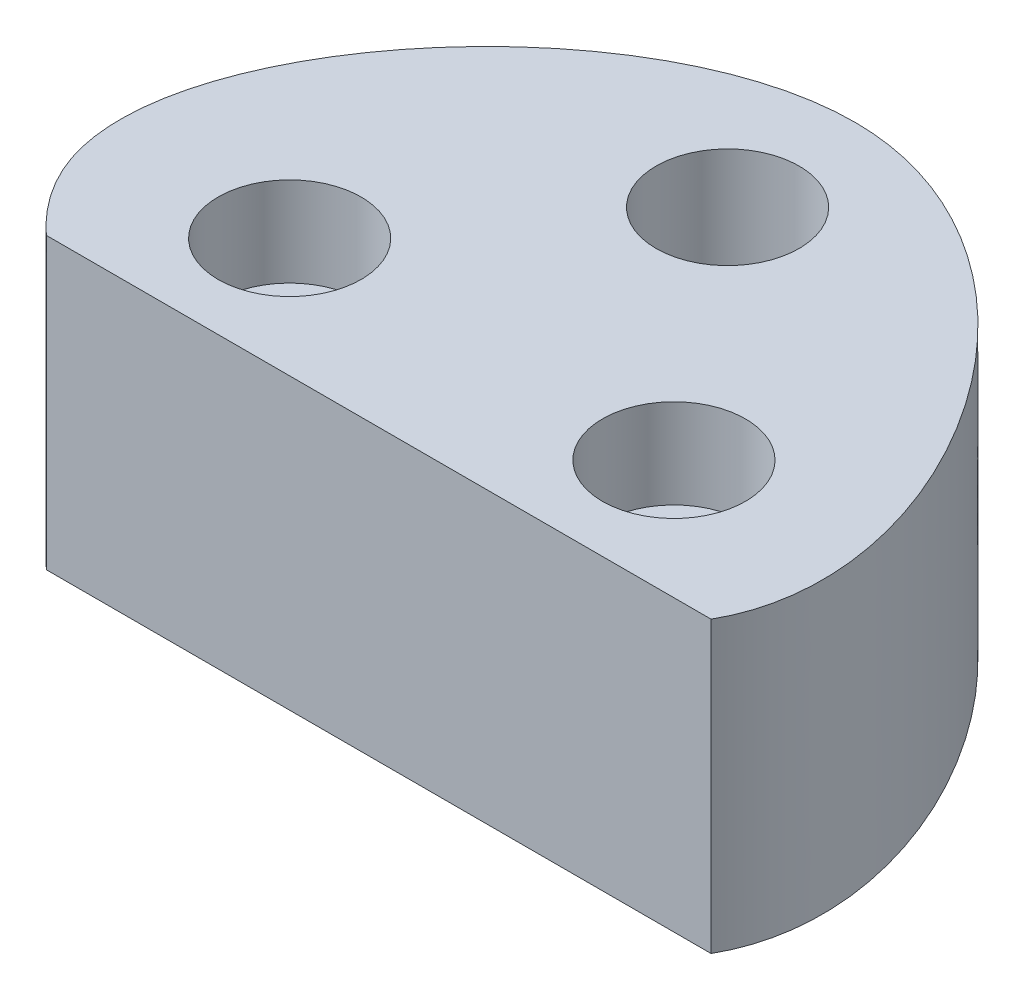
from build123d import *

# Parameters (mm, degrees)
SKETCH2_R           = 50
BOSS_EXTRUDE1_DEPTH = 16.2
SKETCH7_R           = 4
CUT_EXTRUDE2_DEPTH  = 5
SKETCH4_R           = 4
CUT_EXTRUDE3_DEPTH  = 18
CUT_EXTRUDE6_START  = -20
SKETCH10_R          = 50
CUT_EXTRUDE6_DEPTH  = 20
SKETCH10_5_W        = 37.880831295
SKETCH10_5_H        = 13.400021955
CUT_EXTRUDE7_DEPTH  = 20


with BuildPart() as part:
    # Sketch2 → Boss-Extrude1 (new body)
    with BuildSketch(Plane(origin=(0, 0, 0), x_dir=(1, 0, 0), z_dir=(0, 1, 0))):
        with Locations(Location((0, 0, 0), (0, 0, 270))):
            Circle(SKETCH2_R)
    extrude(amount=BOSS_EXTRUDE1_DEPTH)

    # Sketch7 → Cut-Extrude2 (cut)
    with BuildSketch(Plane(origin=(0, 16.2, 0), x_dir=(1, 0, 0), z_dir=(0, 1, 0))):
        with Locations(Location((-10.75, -13.75, 0), (0, 0, 270))):
            Circle(SKETCH7_R)
    cut_extrude2 = extrude(amount=-CUT_EXTRUDE2_DEPTH, mode=Mode.SUBTRACT)

    # Mirror1: Cut-Extrude2 across plane
    add(cut_extrude2.mirror(Plane(origin=(0, 0, 0), x_dir=(0, 0, 1), z_dir=(1, 0, 0))), mode=Mode.SUBTRACT)

    # Sketch4 → Cut-Extrude3 (cut)
    with BuildSketch(Plane(origin=(0, 16.2, 0), x_dir=(1, 0, 0), z_dir=(0, 1, 0))):
        with Locations(Location((0, 0, 0), (0, 0, 270))):
            Circle(SKETCH4_R)
    extrude(amount=-CUT_EXTRUDE3_DEPTH, mode=Mode.SUBTRACT)

    # Sketch10 → Cut-Extrude6 (cut)
    with BuildSketch(Plane(origin=(0, 16.2, 0), x_dir=(1, 0, 0), z_dir=(0, 1, 0)).offset(CUT_EXTRUDE6_START)):
        Circle(SKETCH10_R)
        with BuildLine():
            Line((-18.389453031, -33.817018788), (-18.389453031, -20.416996833))
            Line((-18.389453031, -20.416996833), (-17.695652793, -20.416996833))
            add(Edge.make_bspline(
                [(0, 7.671510726), (-11.676219754, 8.158908111), (-26.132266975, -9.274364796), (-19.091439708, -19.131313204), (-17.695652793, -20.416996833)],
                knots=[0, 0, 0, 0, 0.296673026, 0.348421636, 0.348421636, 0.348421636, 0.348421636], degree=3))
            add(Edge.make_bspline(
                [(19.491378264, -20.416996833), (24.616575565, -11.472242374), (12.681498722, 7.142150245), (0, 7.671510726)],
                knots=[0.677784533, 0.677784533, 0.677784533, 0.677784533, 1, 1, 1, 1], degree=3))
            Line((19.491378264, -20.416996833), (19.491378264, -33.817018788))
            Line((19.491378264, -33.817018788), (-18.389453031, -33.817018788))
        make_face(mode=Mode.SUBTRACT)
    extrude(amount=CUT_EXTRUDE6_DEPTH, mode=Mode.SUBTRACT)

    # Sketch10<5> → Cut-Extrude7 (cut)
    with BuildSketch(Plane(origin=(0, 16.2, 0), x_dir=(1, 0, 0), z_dir=(0, 1, 0))):
        with BuildLine():
            Line((19.491378264, -20.416996833), (-17.695652793, -20.416996833))
            add(Edge.make_bspline(
                [(-17.695652793, -20.416996833), (-8.811927665, -28.599950719), (14.252493091, -29.560165139), (19.491378264, -20.416996833)],
                knots=[0.348421636, 0.348421636, 0.348421636, 0.348421636, 0.677784533, 0.677784533, 0.677784533, 0.677784533], degree=3))
        make_face()
        with Locations((0.550962616, -27.11700781)):
            Rectangle(SKETCH10_5_W, SKETCH10_5_H)
    extrude(amount=-CUT_EXTRUDE7_DEPTH, mode=Mode.SUBTRACT)


solid = part.part
